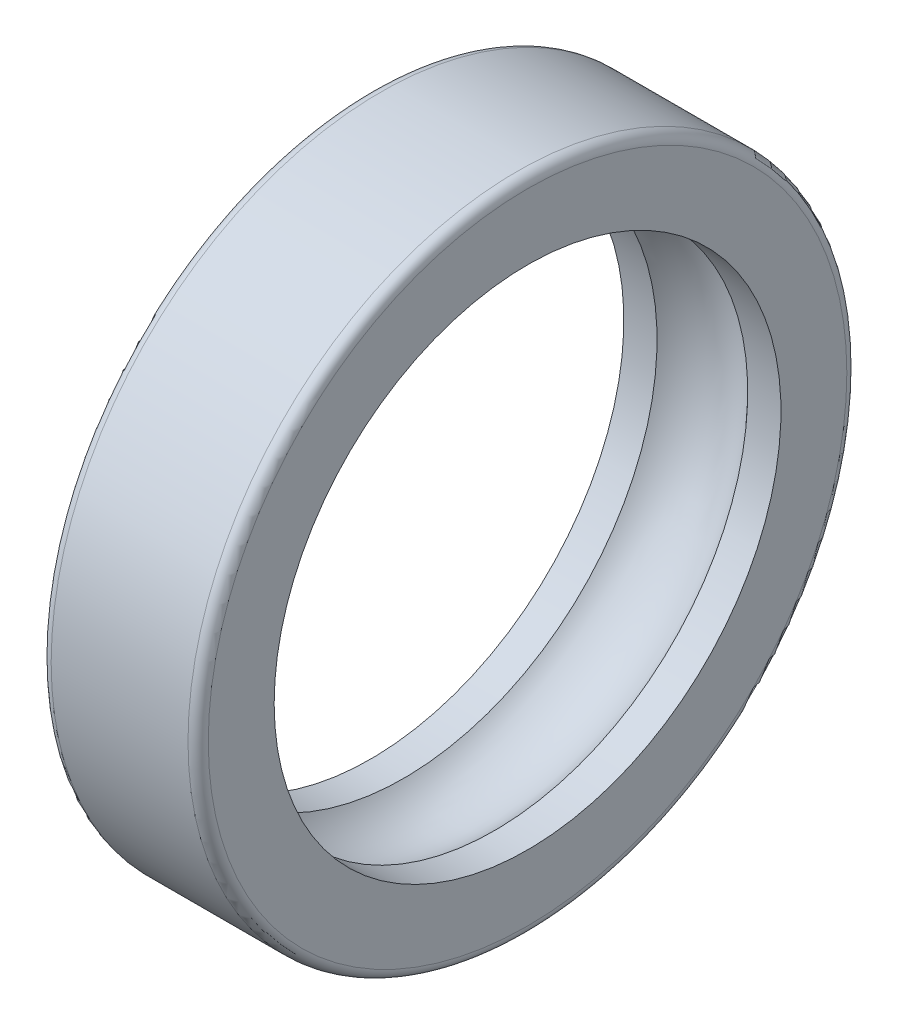
from build123d import *


with BuildPart() as part:
    # Sketch1 → Revolve1 (revolve)
    with BuildSketch(Plane.XY, mode=Mode.PRIVATE) as revolve1_sk:
        with BuildLine():
            Line((-13.5, 65), (13.5, 65))
            ThreePointArc((13.5, 65), (14.914213562, 64.414213562), (15.5, 63))
            Line((15.5, 63), (15.5, 50))
            Line((15.5, 50), (8.94427191, 50))
            ThreePointArc((8.94427191, 50), (0, 54), (-8.94427191, 50))
            Line((-8.94427191, 50), (-15.5, 50))
            Line((-15.5, 50), (-15.5, 63))
            ThreePointArc((-15.5, 63), (-14.914213562, 64.414213562), (-13.5, 65))
        make_face()
    revolve(revolve1_sk.sketch.rotate(Axis((0, 0, 0), (1, 0, 0)), 90), axis=Axis((0, 0, 0), (1, 0, 0)))


solid = part.part
